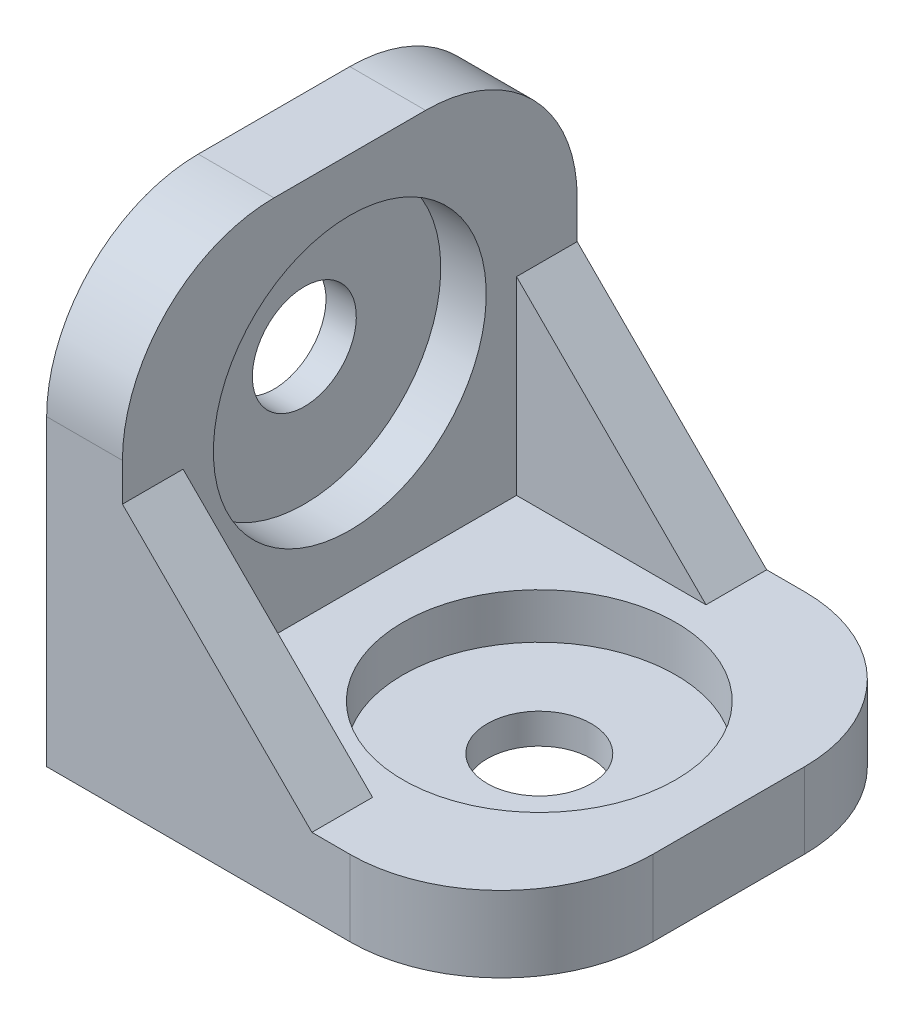
from build123d import *

# Parameters (mm, degrees)
BOSS_EXTRUDE1_DEPTH     = 30
SKETCH2_R               = 3.429
CUT_EXTRUDE1_DEPTH      = 50.244289009
CUT_EXTRUDE2_DEPTH      = 50.244289009
CUT_EXTRUDE2_DEPTH_BACK = 50.244289009
SKETCH4_R               = 3.429
SKETCH7_R               = 9
CUT_EXTRUDE3_DEPTH      = 3
SKETCH8_R               = 9
CUT_EXTRUDE4_DEPTH      = 3
BOSS_EXTRUDE2_DEPTH     = 4
BOSS_EXTRUDE3_DEPTH     = 4
FILLET1_R               = 10


with BuildPart() as part:
    # Sketch1 → Boss-Extrude1 (new body)
    with BuildSketch(Plane.XY):
        Polygon((0, 30), (0, 0), (30, 0), (30, 5), (5, 5), (5, 30), align=None)
    extrude(amount=BOSS_EXTRUDE1_DEPTH)

    # Sketch2 → Cut-Extrude1 (cut, through all)
    with BuildSketch(Plane(origin=(5, 0, 0), x_dir=(0, 0, -1), z_dir=(1, 0, 0))):
        with Locations(Location((-15, 17.5, 0), (0, 0, 90))):
            Circle(SKETCH2_R)
    extrude(amount=-CUT_EXTRUDE1_DEPTH, mode=Mode.SUBTRACT)

    # Sketch4 → Cut-Extrude2 (cut, two sides: drawn at the far end of the back side and taken through both)
    with BuildSketch(Plane(origin=(0, 5, 0), x_dir=(1, 0, 0), z_dir=(0, 1, 0)).offset(-CUT_EXTRUDE2_DEPTH_BACK)):
        with Locations(Location((17.5, -15, 0), (0, 0, 180))):
            Circle(SKETCH4_R)
    extrude(amount=CUT_EXTRUDE2_DEPTH + CUT_EXTRUDE2_DEPTH_BACK, mode=Mode.SUBTRACT)

    # Sketch7 → Cut-Extrude3 (cut)
    with BuildSketch(Plane(origin=(0, 5, 0), x_dir=(1, 0, 0), z_dir=(0, 1, 0))):
        with Locations(Location((17.5, -15, 0), (0, 0, 180))):
            Circle(SKETCH7_R)
    extrude(amount=-CUT_EXTRUDE3_DEPTH, mode=Mode.SUBTRACT)

    # Sketch8 → Cut-Extrude4 (cut)
    with BuildSketch(Plane(origin=(5, 0, 0), x_dir=(0, 0, -1), z_dir=(1, 0, 0))):
        with Locations(Location((-15, 17.5, 0), (0, 0, 90))):
            Circle(SKETCH8_R)
    extrude(amount=-CUT_EXTRUDE4_DEPTH, mode=Mode.SUBTRACT)

    # Sketch9 → Boss-Extrude2 (add)
    with BuildSketch(Plane(origin=(0, 0, 0), x_dir=(-1, 0, 0), z_dir=(0, 0, -1))):
        Polygon((-17.5, 5), (-5, 17.5), (-5, 5), align=None)
    extrude(amount=-BOSS_EXTRUDE2_DEPTH)

    # Sketch10 → Boss-Extrude3 (add)
    with BuildSketch(Plane.XY.offset(30)):
        Polygon((5, 5), (17.5, 5), (5, 17.5), align=None)
    extrude(amount=-BOSS_EXTRUDE3_DEPTH)

    # Fillet1
    fillet1_edges = [part.edges().sort_by_distance(p)[0] for p in [
        (30, 2.5, 30),
        (2.5, 30, 30),
        (30, 2.5, 0),
        (2.5, 30, 0),
    ]]
    fillet(fillet1_edges, radius=FILLET1_R)


solid = part.part
